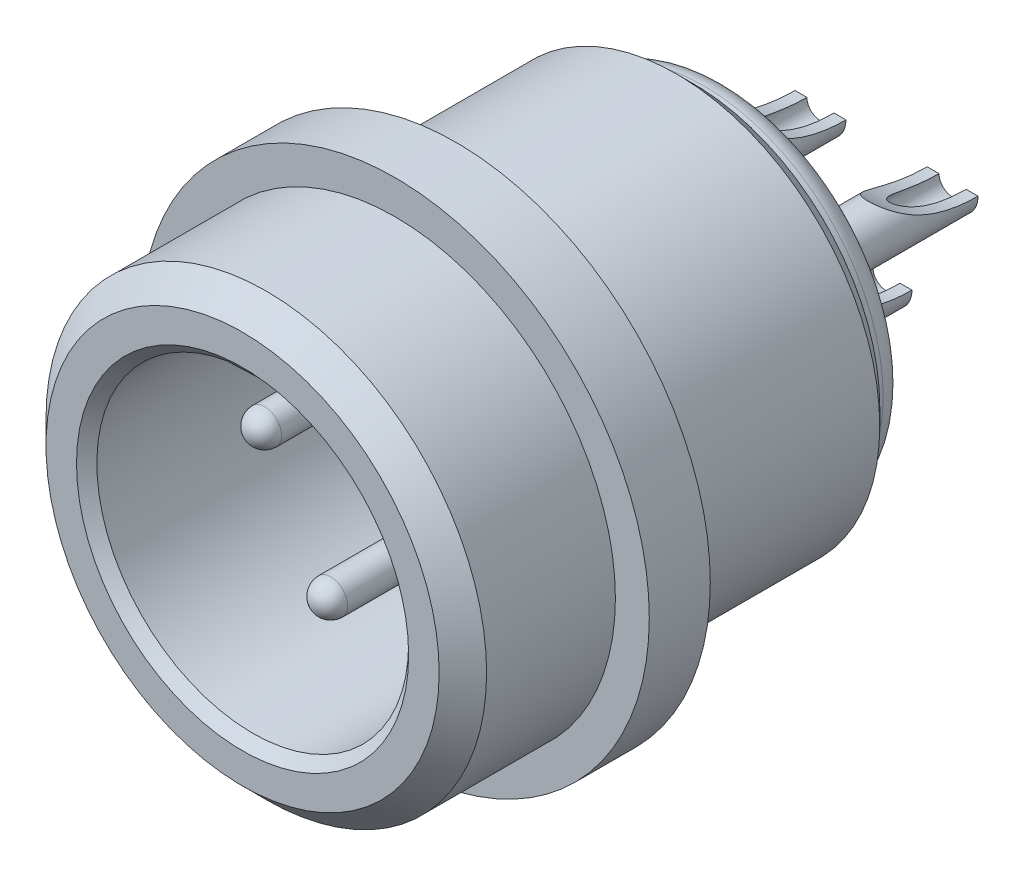
from build123d import *

# Parameters (mm, degrees)
EXTRUDE_1_DEPTH          = 6.6
EXTRUDE_1_DEPTH_BACK     = 6
SKETCH_2_R               = 0.5
SKETCH_8_R               = 0.75
EXTRUDE_1_2_DEPTH        = 8.7
FILLET_1_R               = 0.5
EXTRUDE_6_DEPTH          = 0.1
SKETCH_11_R              = 0.75
EXTRUDE_2_DEPTH          = 5
SKETCH_12_R              = 0.4
CUT_EXTRUDE_1_DEPTH      = 5
CUT_EXTRUDE_3_DEPTH      = 4
CUT_EXTRUDE_3_DEPTH_BACK = 4


with BuildPart() as part:
    # Эскиз1 → Повернуть1 (revolve)
    with BuildSketch(Plane(origin=(0, 0, 0), x_dir=(0, 0, -1), z_dir=(1, 0, 0)), mode=Mode.PRIVATE) as revolve_1_sk:
        with BuildLine():
            Line((0, 4.6), (0, 5.8))
            Line((0, 5.8), (0.7, 6.5))
            Line((0.7, 6.5), (4.5, 6.5))
            Line((4.5, 6.5), (4.5, 7.5))
            Line((4.5, 7.5), (6.3, 7.5))
            Line((6.3, 7.5), (6.3, 6))
            Line((6.3, 6), (12.8, 6))
            Line((12.8, 6), (13.3, 5.5))
            Line((13.3, 5.5), (13.3, 5.3))
            Line((13.3, 5.3), (13.6, 5.3))
            ThreePointArc((13.6, 5.3), (14.094974747, 5.094974747), (14.3, 4.6))
            Line((14.3, 4.6), (14.3, 4.5))
            Line((14.3, 4.5), (14, 4.5))
            Line((14, 4.5), (14, 0))
            Line((14, 0), (8.7, 0))
            Line((8.7, 0), (8.7, 4.6))
            Line((8.7, 4.6), (0, 4.6))
        make_face()
    revolve(revolve_1_sk.sketch.rotate(Axis((0, 0, 0), (0, 0, -1)), 90), axis=Axis((0, 0, 0), (0, 0, -1)))

    # Эскиз2 → Extrude 1 (add, two sides: drawn at the far end of the back side and taken through both)
    with BuildSketch(Plane.XY.offset(-8.7).offset(-EXTRUDE_1_DEPTH_BACK)):
        with Locations((1.948557159, 1.125)):
            Circle(SKETCH_2_R)
        with Locations((0, -2.25)):
            Circle(SKETCH_2_R)
        with Locations((-1.948557159, 1.125)):
            Circle(SKETCH_2_R)
    extrude(amount=EXTRUDE_1_DEPTH + EXTRUDE_1_DEPTH_BACK)

    # Эскиз8 → Extrude 1 2 (add)
    with BuildSketch(Plane.XY.offset(-8.7)):
        with Locations((0, 4.6)):
            Circle(SKETCH_8_R)
    extrude(amount=EXTRUDE_1_2_DEPTH)

    # Скругление1
    fillet_1_edges = [part.edges().sort_by_distance(p)[0] for p in [
        (1.448557159, 1.125, -2.1),
        (-0.5, -2.25, -2.1),
        (-2.448557159, 1.125, -2.1),
    ]]
    fillet(fillet_1_edges, radius=FILLET_1_R)

    # Эскиз10 → Вырез-Повернуть1 (revolve, cut)
    with BuildSketch(Plane(origin=(0, 0, 0), x_dir=(0, 0, -1), z_dir=(0, 1, 0)), mode=Mode.PRIVATE) as cut_revolve_1_sk:
        Polygon((0, 4.9), (2, 2.9), (0, 2.9), align=None)
    revolve(cut_revolve_1_sk.sketch.rotate(Axis((0, 0, 0), (0, 0, -1)), 180), axis=Axis((0, 0, 0), (0, 0, -1)), mode=Mode.SUBTRACT)

    # Эскиз7 → Вытянуть6 (add)
    with BuildSketch(Plane(origin=(0, 0, -14), x_dir=(-1, 0, 0), z_dir=(0, 0, -1))):
        with BuildLine():
            Line((-2.252305375, -1.858168468), (-2.439092189, -1.858168468))
            Line((-2.439092189, -1.858168468), (-2.439092189, -0.433919015))
            add(Edge.make_bspline(
                [(-2.439092189, -0.433919015), (-2.450563449, -0.44712342), (-2.474337624, -0.474489534), (-2.515608372, -0.513407962), (-2.561600062, -0.553540801), (-2.612518968, -0.592483833), (-2.664401281, -0.629784956), (-2.715644706, -0.662591943), (-2.764328664, -0.691136494), (-2.796988728, -0.706651777), (-2.812665816, -0.714099235)],
                knots=[0, 0, 0, 0, 0.892555828, 1.849821039, 2.893015883, 4.008277588, 5.121255548, 6.154629642, 7.114207698, 8, 8, 8, 8], degree=3))
            Line((-2.812665816, -0.714099235), (-2.812665816, -0.50396407))
            add(Edge.make_bspline(
                [(-2.812665816, -0.50396407), (-2.787471471, -0.488801155), (-2.737298514, -0.458605159), (-2.666999634, -0.406295945), (-2.600589191, -0.349836747), (-2.540052176, -0.288636001), (-2.485847929, -0.225547194), (-2.439323176, -0.162584487), (-2.401175827, -0.10041685), (-2.38246333, -0.057652687), (-2.37342495, -0.036997037)],
                knots=[0, 0, 0, 0, 1.082272232, 2.155277244, 3.222407096, 4.289527553, 5.32168536, 6.282742408, 7.170542132, 8, 8, 8, 8], degree=3))
            Line((-2.37342495, -0.036997037), (-2.252305375, -0.036997037))
            Line((-2.252305375, -0.036997037), (-2.252305375, -1.858168468))
        make_face()
        with BuildLine():
            Line((2.792481334, -1.648033303), (2.792481334, -1.858168468))
            Line((2.792481334, -1.858168468), (1.835198915, -1.858168468))
            add(Edge.make_bspline(
                [(1.835198915, -1.858168468), (1.835154592, -1.847219547), (1.835064793, -1.825036853), (1.838050317, -1.791217379), (1.844184332, -1.756579116), (1.852016842, -1.720659984), (1.863122488, -1.683932397), (1.876717859, -1.646217897), (1.892759201, -1.607610379), (1.91154215, -1.567881194), (1.93349097, -1.526649256), (1.959976834, -1.484087071), (1.990415661, -1.439431169), (2.024847703, -1.392953787), (2.063946372, -1.345095707), (2.106551177, -1.295146481), (2.153270146, -1.243210146), (2.186534151, -1.208692776), (2.20366509, -1.190916355)],
                knots=[0, 0, 0, 0, 0.672188691, 1.361865275, 2.08134618, 2.831455259, 3.618325166, 4.435686407, 5.292818481, 6.184803937, 7.133719261, 8.159707436, 9.261705982, 10.452168352, 11.710682541, 13.056179633, 14.483934645, 16, 16, 16, 16], degree=3))
            add(Edge.make_bspline(
                [(2.20366509, -1.190916355), (2.223573161, -1.170324862), (2.261904603, -1.130677545), (2.315852448, -1.072135851), (2.364869483, -1.017722075), (2.407976379, -0.966452253), (2.445938443, -0.919024667), (2.479137613, -0.875507127), (2.505987301, -0.83491203), (2.53497733, -0.787146068), (2.562615205, -0.730281447), (2.587048652, -0.663996733), (2.602835786, -0.599919141), (2.60476016, -0.557674149), (2.60569452, -0.537162508)],
                knots=[0, 0, 0, 0, 1.312560889, 2.527233899, 3.64818266, 4.668586789, 5.596397896, 6.432357998, 7.175835261, 7.825761013, 8.992224112, 10.065918602, 11.060925749, 12, 12, 12, 12], degree=3))
            add(Edge.make_bspline(
                [(2.60569452, -0.537162508), (2.605564236, -0.525838449), (2.605309778, -0.503721378), (2.600985621, -0.471421761), (2.594818802, -0.440699822), (2.586676774, -0.411333529), (2.575132318, -0.383805229), (2.561300112, -0.357923929), (2.545097646, -0.333572411), (2.526608171, -0.311108284), (2.506218486, -0.290842834), (2.48473062, -0.272636873), (2.461585582, -0.257901813), (2.43773464, -0.245074645), (2.412371822, -0.235778299), (2.386031205, -0.228692079), (2.358469087, -0.224696546), (2.339754217, -0.224091098), (2.330256934, -0.22378385)],
                knots=[0, 0, 0, 0, 1.164486654, 2.274364258, 3.346924328, 4.388668322, 5.404300818, 6.412115579, 7.404820287, 8.409522099, 9.400647826, 10.360464378, 11.301161788, 12.219192522, 13.141987859, 14.073903283, 15.022558797, 16, 16, 16, 16], degree=3))
            add(Edge.make_bspline(
                [(2.330256934, -0.22378385), (2.320017001, -0.223998672), (2.300028181, -0.224418013), (2.270893172, -0.22962929), (2.242976482, -0.23660095), (2.216419773, -0.247413386), (2.191417295, -0.261263458), (2.167608873, -0.277934655), (2.145460529, -0.297742098), (2.1245261, -0.320265532), (2.106174407, -0.345949385), (2.08932486, -0.373742122), (2.076056552, -0.404821041), (2.064774662, -0.438227824), (2.055939167, -0.474351883), (2.050033344, -0.51305698), (2.045702312, -0.554333678), (2.045459081, -0.582752455), (2.04533408, -0.597357477)],
                knots=[0, 0, 0, 0, 0.928788257, 1.813037313, 2.680996359, 3.53827917, 4.408273621, 5.272359245, 6.172129225, 7.102295458, 8.058839945, 9.034325244, 10.048074492, 11.120300332, 12.234644845, 13.420320921, 14.674247329, 16, 16, 16, 16], degree=3))
            Line((2.04533408, -0.597357477), (1.858547266, -0.574009125))
            add(Edge.make_bspline(
                [(1.858547266, -0.574009125), (1.860472195, -0.552334001), (1.864206645, -0.510283275), (1.874004802, -0.449408321), (1.887601509, -0.39292727), (1.903741648, -0.340276654), (1.924047803, -0.292109894), (1.946750728, -0.247550411), (1.973659132, -0.207566846), (2.003666443, -0.171664894), (2.03652136, -0.139812542), (2.072038709, -0.112318306), (2.11017026, -0.089141183), (2.150480548, -0.069652961), (2.193802805, -0.055100025), (2.239359831, -0.04453783), (2.287522158, -0.038280281), (2.320388494, -0.037431103), (2.337188476, -0.036997037)],
                knots=[0, 0, 0, 0, 1.296155121, 2.514599762, 3.669097984, 4.755193195, 5.79120272, 6.77953026, 7.729955905, 8.65570694, 9.562583864, 10.450894749, 11.325630111, 12.216772649, 13.112585423, 14.04224033, 14.999270054, 16, 16, 16, 16], degree=3))
            add(Edge.make_bspline(
                [(2.337188476, -0.036997037), (2.355327595, -0.037529491), (2.390647472, -0.038566268), (2.442064889, -0.045397801), (2.490021028, -0.057448166), (2.534730094, -0.074216436), (2.575655143, -0.096291401), (2.61346186, -0.122770925), (2.647519294, -0.154459957), (2.677827301, -0.190517604), (2.704611959, -0.229446164), (2.727983323, -0.27015205), (2.748256105, -0.311960771), (2.764099857, -0.355337543), (2.777331076, -0.399700215), (2.785643217, -0.445721269), (2.791494904, -0.492869706), (2.792150667, -0.524740109), (2.792481334, -0.540810688)],
                knots=[0, 0, 0, 0, 1.141256367, 2.222215694, 3.255808886, 4.246221905, 5.218350639, 6.173592628, 7.142736081, 8.136099926, 9.131465336, 10.11177911, 11.087094076, 12.050634184, 13.014356534, 13.995714735, 14.989343724, 16, 16, 16, 16], degree=3))
            add(Edge.make_bspline(
                [(2.792481334, -0.540810688), (2.792169783, -0.555289576), (2.79155074, -0.584058715), (2.787523816, -0.626983902), (2.780415548, -0.669331994), (2.771185776, -0.711510179), (2.758088666, -0.752865389), (2.743262039, -0.794054446), (2.72527849, -0.834612681), (2.704048463, -0.875331783), (2.67919086, -0.917652702), (2.649403229, -0.962347841), (2.615237986, -1.010611919), (2.575307389, -1.061584977), (2.531546275, -1.116732858), (2.482021353, -1.174665995), (2.427698882, -1.235895255), (2.389427121, -1.277441273), (2.369657277, -1.298902481)],
                knots=[0, 0, 0, 0, 0.78053567, 1.550902233, 2.321464013, 3.094364546, 3.87611052, 4.657966429, 5.453363508, 6.265521698, 7.132350641, 8.097801917, 9.160103787, 10.319208993, 11.587678713, 12.955014444, 14.427067756, 16, 16, 16, 16], degree=3))
            add(Edge.make_bspline(
                [(2.369657277, -1.298902481), (2.357106705, -1.312255679), (2.333121553, -1.337774713), (2.299155704, -1.374701074), (2.268676125, -1.408292526), (2.241019221, -1.438076163), (2.217552286, -1.465053609), (2.197206734, -1.48851222), (2.180582856, -1.508741143), (2.155668882, -1.540542275), (2.124245906, -1.585349783), (2.102536462, -1.627591569), (2.092030783, -1.648033303)],
                knots=[0, 0, 0, 0, 1.227496676, 2.345844757, 3.360613726, 4.265798447, 5.068085109, 5.75545707, 6.345771879, 6.821573405, 8.46188917, 10, 10, 10, 10], degree=3))
            Line((2.092030783, -1.648033303), (2.792481334, -1.648033303))
        make_face()
        with BuildLine():
            Line((-0.512241355, -0.461696041), (-0.325454542, -0.43834769))
            add(Edge.make_bspline(
                [(-0.325454542, -0.43834769), (-0.323045503, -0.452482567), (-0.318351168, -0.48002627), (-0.309114798, -0.519662831), (-0.299034171, -0.55675235), (-0.287350501, -0.590945668), (-0.27461496, -0.622576774), (-0.260492103, -0.651443982), (-0.244702227, -0.677542459), (-0.227633993, -0.700887333), (-0.209234682, -0.721589154), (-0.18958799, -0.739512318), (-0.16850992, -0.754644003), (-0.146201399, -0.767236792), (-0.1223094, -0.776578652), (-0.09730336, -0.78370835), (-0.07081586, -0.787673771), (-0.052704642, -0.788268879), (-0.043450232, -0.788572965)],
                knots=[0, 0, 0, 0, 1.392235382, 2.712957193, 3.95076201, 5.123471921, 6.220028287, 7.260520794, 8.240826993, 9.178593426, 10.065213643, 10.926376853, 11.755607984, 12.580369742, 13.407158359, 14.241002189, 15.101193065, 16, 16, 16, 16], degree=3))
            add(Edge.make_bspline(
                [(-0.043450232, -0.788572965), (-0.033328277, -0.788380373), (-0.013433402, -0.78800183), (0.015721179, -0.782362508), (0.044046464, -0.774663556), (0.071054033, -0.762672148), (0.097219459, -0.747937752), (0.122575511, -0.730160984), (0.146125752, -0.708184573), (0.169059186, -0.684026795), (0.190210995, -0.657208016), (0.208448851, -0.627916009), (0.223808703, -0.59658011), (0.236697738, -0.56357509), (0.245921332, -0.528364466), (0.253519399, -0.491649955), (0.257330715, -0.452655483), (0.257941283, -0.426071898), (0.25825425, -0.412445612)],
                knots=[0, 0, 0, 0, 0.904038564, 1.776903143, 2.648138989, 3.525264603, 4.411852617, 5.332561374, 6.2875971, 7.288147468, 8.311042921, 9.337403868, 10.368883854, 11.429611823, 12.501164111, 13.621320171, 14.780729868, 16, 16, 16, 16], degree=3))
            add(Edge.make_bspline(
                [(0.25825425, -0.412445612), (0.257923423, -0.399669381), (0.257279313, -0.374794468), (0.253736616, -0.338409291), (0.247245546, -0.3039379), (0.237546926, -0.271474453), (0.226061948, -0.240518894), (0.211402297, -0.211703236), (0.194103032, -0.184862553), (0.174531678, -0.160187347), (0.152923895, -0.137949151), (0.130135833, -0.118155293), (0.105798007, -0.101705972), (0.080523705, -0.087855345), (0.053623685, -0.077899378), (0.025881847, -0.069974688), (-0.003303034, -0.065597821), (-0.023128561, -0.065052208), (-0.033235328, -0.064774063)],
                knots=[0, 0, 0, 0, 1.208507307, 2.352925112, 3.453685551, 4.520081629, 5.553915499, 6.572344605, 7.570902253, 8.569592363, 9.545641393, 10.499968035, 11.418701314, 12.319183888, 13.218416966, 14.125267075, 15.044288268, 16, 16, 16, 16], degree=3))
            add(Edge.make_bspline(
                [(-0.033235328, -0.064774063), (-0.042374449, -0.065061684), (-0.06185654, -0.065674812), (-0.092533866, -0.070977198), (-0.126484095, -0.078429642), (-0.149784341, -0.085742641), (-0.16201608, -0.089581687)],
                knots=[0, 0, 0, 0, 0.832645691, 1.774971563, 2.831945141, 4, 4, 4, 4], degree=3))
            Line((-0.16201608, -0.089581687), (-0.138667728, 0.122012751))
            Line((-0.138667728, 0.122012751), (-0.110576743, 0.119459025))
            add(Edge.make_bspline(
                [(-0.110576743, 0.119459025), (-0.099736529, 0.119581964), (-0.078583608, 0.119821861), (-0.047647057, 0.124255045), (-0.01813601, 0.130128408), (0.009650959, 0.139042347), (0.036051612, 0.149999997), (0.060654628, 0.163889152), (0.083908857, 0.18008432), (0.105398495, 0.198586282), (0.124689946, 0.219503531), (0.14192312, 0.241958561), (0.156167809, 0.26630233), (0.168004548, 0.292058758), (0.177080593, 0.319600098), (0.183704203, 0.348781656), (0.187224816, 0.379732263), (0.187875454, 0.400847355), (0.188209195, 0.411678239)],
                knots=[0, 0, 0, 0, 1.104467345, 2.155189185, 3.181695374, 4.170183668, 5.126157628, 6.092295424, 7.04536858, 8.012620263, 8.977961638, 9.942904556, 10.893715412, 11.848320646, 12.828840281, 13.845861792, 14.895045293, 16, 16, 16, 16], degree=3))
            add(Edge.make_bspline(
                [(0.188209195, 0.411678239), (0.187372019, 0.431079276), (0.185763116, 0.4683646), (0.173412946, 0.52146977), (0.151892214, 0.568476122), (0.122266196, 0.608665426), (0.086615087, 0.641051606), (0.046788577, 0.665321563), (0.002619758, 0.679701567), (-0.02814636, 0.681471694), (-0.04381505, 0.682373191)],
                knots=[0, 0, 0, 0, 1.168747258, 2.246123166, 3.262822778, 4.26410748, 5.234436762, 6.148309006, 7.056963545, 8, 8, 8, 8], degree=3))
            add(Edge.make_bspline(
                [(-0.04381505, 0.682373191), (-0.060096235, 0.681616187), (-0.091768783, 0.680143551), (-0.137058477, 0.666095231), (-0.178725535, 0.644574811), (-0.209099119, 0.618691172), (-0.2306232, 0.594184886), (-0.245810053, 0.573534341), (-0.259304899, 0.550571164), (-0.270741876, 0.525090315), (-0.28174934, 0.49779523), (-0.289533959, 0.467754731), (-0.297309505, 0.435884357), (-0.300473447, 0.413661177), (-0.30210619, 0.402192971)],
                knots=[0, 0, 0, 0, 1.389180941, 2.702438466, 4.019316734, 5.377896697, 6.085434137, 6.807430375, 7.567469407, 8.358691296, 9.195188439, 10.081130764, 11.009773198, 12, 12, 12, 12], degree=3))
            Line((-0.30210619, 0.402192971), (-0.488893004, 0.425541322))
            add(Edge.make_bspline(
                [(-0.488893004, 0.425541322), (-0.485834493, 0.443341247), (-0.479868251, 0.478063583), (-0.467403376, 0.528027113), (-0.452568524, 0.574703368), (-0.434607075, 0.617835326), (-0.41421266, 0.65779743), (-0.391138275, 0.694421036), (-0.365684463, 0.727946588), (-0.336966926, 0.757448106), (-0.30644502, 0.783723624), (-0.274101018, 0.806415645), (-0.240511591, 0.825947416), (-0.205123106, 0.841682547), (-0.168267856, 0.854159772), (-0.129761305, 0.862891239), (-0.08980131, 0.868052985), (-0.062679115, 0.868787468), (-0.048922502, 0.869160004)],
                knots=[0, 0, 0, 0, 1.259750421, 2.457396855, 3.589696629, 4.673763457, 5.713494597, 6.716289503, 7.690389722, 8.644478697, 9.583164327, 10.496506905, 11.397350125, 12.289843847, 13.194037124, 14.107891875, 15.040306322, 16, 16, 16, 16], degree=3))
            add(Edge.make_bspline(
                [(-0.048922502, 0.869160004), (-0.034427505, 0.868732435), (-0.005910812, 0.867891259), (0.036002753, 0.861436981), (0.076312173, 0.851376906), (0.114910135, 0.836709935), (0.151453556, 0.817389993), (0.186842579, 0.794734872), (0.220480503, 0.767591342), (0.251840132, 0.736402867), (0.280625467, 0.702273886), (0.305873284, 0.665604165), (0.327558893, 0.627012773), (0.344778766, 0.585940668), (0.358238466, 0.542802494), (0.368073994, 0.497528098), (0.374096664, 0.450025624), (0.374691678, 0.417655061), (0.374996008, 0.401098517)],
                knots=[0, 0, 0, 0, 0.987546189, 1.94284647, 2.883618689, 3.814886987, 4.749064414, 5.696240478, 6.674807358, 7.688712876, 8.706405422, 9.713376545, 10.718845743, 11.717906576, 12.742863162, 13.794678478, 14.872046121, 16, 16, 16, 16], degree=3))
            add(Edge.make_bspline(
                [(0.374996008, 0.401098517), (0.374434035, 0.381107168), (0.373336508, 0.342064358), (0.362757504, 0.28542947), (0.345968654, 0.232296266), (0.32255235, 0.18301816), (0.293372908, 0.137848324), (0.258324754, 0.097892986), (0.218325513, 0.062476872), (0.187911852, 0.043871212), (0.172522021, 0.034456432)],
                knots=[0, 0, 0, 0, 1.090109576, 2.128968013, 3.132278696, 4.123864162, 5.09769889, 6.057339906, 7.016980922, 8, 8, 8, 8], degree=3))
            add(Edge.make_bspline(
                [(0.172522021, 0.034456432), (0.186658585, 0.030106759), (0.214279638, 0.021608051), (0.252384963, 0.002469389), (0.287130522, -0.019756541), (0.318176312, -0.04641561), (0.345788484, -0.077516841), (0.370444363, -0.113276188), (0.391628235, -0.154035419), (0.410766787, -0.198778645), (0.42576509, -0.247474002), (0.437288176, -0.299147915), (0.443822489, -0.353784805), (0.444628721, -0.391147678), (0.445041064, -0.410256704)],
                knots=[0, 0, 0, 0, 0.945190562, 1.846782401, 2.71900073, 3.580139159, 4.456653473, 5.37426406, 6.352713278, 7.392141409, 8.485180558, 9.608884637, 10.777077804, 12, 12, 12, 12], degree=3))
            add(Edge.make_bspline(
                [(0.445041064, -0.410256704), (0.44468329, -0.430587963), (0.443984804, -0.470280873), (0.436680274, -0.52845863), (0.425625339, -0.583793232), (0.409855663, -0.636482476), (0.38947767, -0.686118728), (0.364312249, -0.732985849), (0.334890081, -0.77708869), (0.301015216, -0.817808694), (0.263975049, -0.854267344), (0.225161195, -0.886848018), (0.184280602, -0.91418059), (0.141681451, -0.936760936), (0.097173214, -0.953907484), (0.050994063, -0.966438954), (0.002876827, -0.973840429), (-0.0298051, -0.974848748), (-0.046368776, -0.975359778)],
                knots=[0, 0, 0, 0, 1.16797173, 2.280242353, 3.364490462, 4.408173669, 5.436152277, 6.443028727, 7.460738993, 8.478233232, 9.481512989, 10.444418881, 11.386528098, 12.302557467, 13.209825675, 14.12198051, 15.04819242, 16, 16, 16, 16], degree=3))
            add(Edge.make_bspline(
                [(-0.046368776, -0.975359778), (-0.061715719, -0.974954526), (-0.091945915, -0.974156267), (-0.136329173, -0.967376428), (-0.178917258, -0.956495281), (-0.219550003, -0.940976179), (-0.25870202, -0.921569308), (-0.295766509, -0.897404864), (-0.331204828, -0.868939814), (-0.364504302, -0.836368667), (-0.394933505, -0.799908365), (-0.422571929, -0.760600703), (-0.446848221, -0.718238276), (-0.466609134, -0.672406398), (-0.483519908, -0.624021843), (-0.497044469, -0.572698971), (-0.506962603, -0.518293382), (-0.510457327, -0.480823903), (-0.512241355, -0.461696041)],
                knots=[0, 0, 0, 0, 0.959274814, 1.889566238, 2.800731978, 3.703256649, 4.604498869, 5.528396462, 6.464265966, 7.442996794, 8.436156864, 9.429840861, 10.444772988, 11.483305447, 12.546329121, 13.647537524, 14.799087218, 16, 16, 16, 16], degree=3))
        make_face()
    extrude(amount=EXTRUDE_6_DEPTH)

    # Эскиз11 → Бобышка-Вытянуть2 (add)
    with BuildSketch(Plane(origin=(0, 0, -14), x_dir=(-1, 0, 0), z_dir=(0, 0, -1))):
        with Locations(Location((-1.948557159, 1.125, 0), (0, 0, 180))):
            Circle(SKETCH_11_R)
        with Locations(Location((0, -2.25, 0), (0, 0, 180))):
            Circle(SKETCH_11_R)
        with Locations(Location((1.948557159, 1.125, 0), (0, 0, 180))):
            Circle(SKETCH_11_R)
    extrude(amount=EXTRUDE_2_DEPTH)

    # Эскиз12 → Вырез-Вытянуть1 (cut)
    with BuildSketch(Plane(origin=(0, 0, -19), x_dir=(-1, 0, 0), z_dir=(0, 0, -1))):
        with Locations((-1.948557159, 1.125)):
            Circle(SKETCH_12_R)
        with Locations((0, -2.25)):
            Circle(SKETCH_12_R)
        with Locations((1.948557159, 1.125)):
            Circle(SKETCH_12_R)
    extrude(amount=-CUT_EXTRUDE_1_DEPTH, mode=Mode.SUBTRACT)

    # Эскиз14 → Вырез-Вытянуть3 (cut, two sides: drawn at the far end of the back side and taken through both)
    with BuildSketch(Plane(origin=(0, 0, 0), x_dir=(0, 0, -1), z_dir=(1, 0, 0)).offset(-CUT_EXTRUDE_3_DEPTH_BACK)):
        with BuildLine():
            Line((19, 1.125), (19, 1.875))
            Line((19, 1.875), (16.5, 1.875))
            ThreePointArc((16.5, 1.875), (17.694961686, 1.316538955), (19, 1.125))
        make_face()
        with BuildLine():
            Line((19, -1.5), (16.5, -1.5))
            ThreePointArc((16.5, -1.5), (17.694961686, -2.058461045), (19, -2.25))
            Line((19, -2.25), (19, -1.5))
        make_face()
    extrude(amount=CUT_EXTRUDE_3_DEPTH + CUT_EXTRUDE_3_DEPTH_BACK, mode=Mode.SUBTRACT)


solid = part.part
